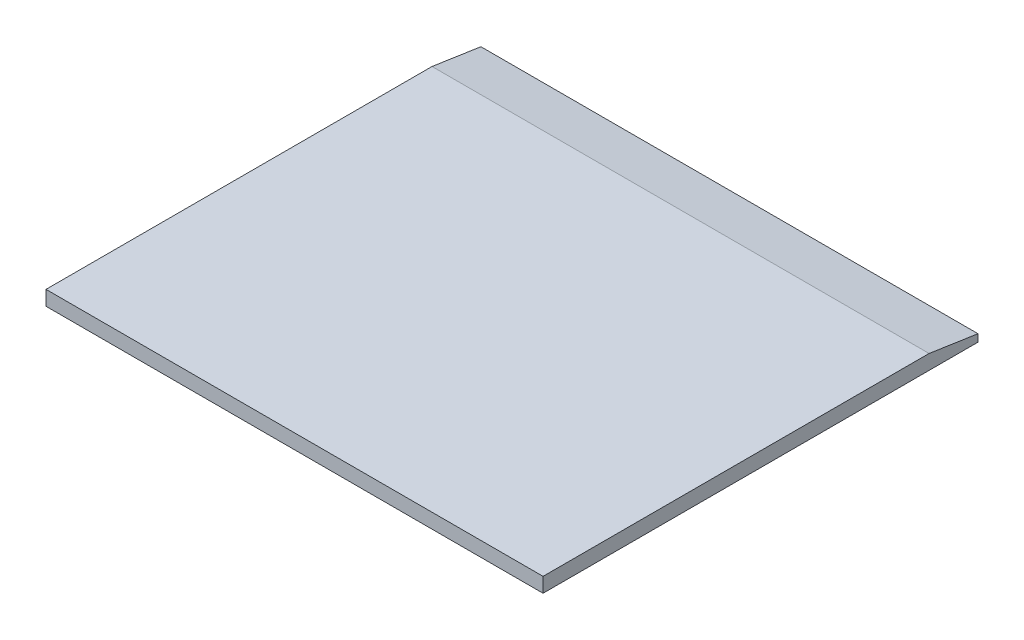
from build123d import *

# Parameters (mm, degrees)
CROQUIS1_W                 = 101.6
CROQUIS1_H                 = 88.9
SALIENTE_EXTRUIR1_DEPTH    = 3
CORTAR_EXTRUIR1_DEPTH      = 136.036180337
CORTAR_EXTRUIR1_DEPTH_BACK = 136.036180337


with BuildPart() as part:
    # Croquis1 → Saliente-Extruir1 (new body)
    with BuildSketch(Plane(origin=(0, 0, 0), x_dir=(1, 0, 0), z_dir=(0, 1, 0))):
        with Locations((50.8, 44.45)):
            Rectangle(CROQUIS1_W, CROQUIS1_H)
    extrude(amount=SALIENTE_EXTRUIR1_DEPTH)

    # Croquis2 → Cortar-Extruir1 (cut, two sides: drawn at the far end of the back side and taken through both)
    with BuildSketch(Plane(origin=(101.6, 0, 0), x_dir=(0, 0, -1), z_dir=(1, 0, 0)).offset(-CORTAR_EXTRUIR1_DEPTH_BACK)):
        Polygon((88.9, 3), (88.9, 1.5), (78.9, 3), (78.9, 5.806097786), (88.9, 5.806097786), align=None)
    extrude(amount=CORTAR_EXTRUIR1_DEPTH + CORTAR_EXTRUIR1_DEPTH_BACK, mode=Mode.SUBTRACT)


solid = part.part
